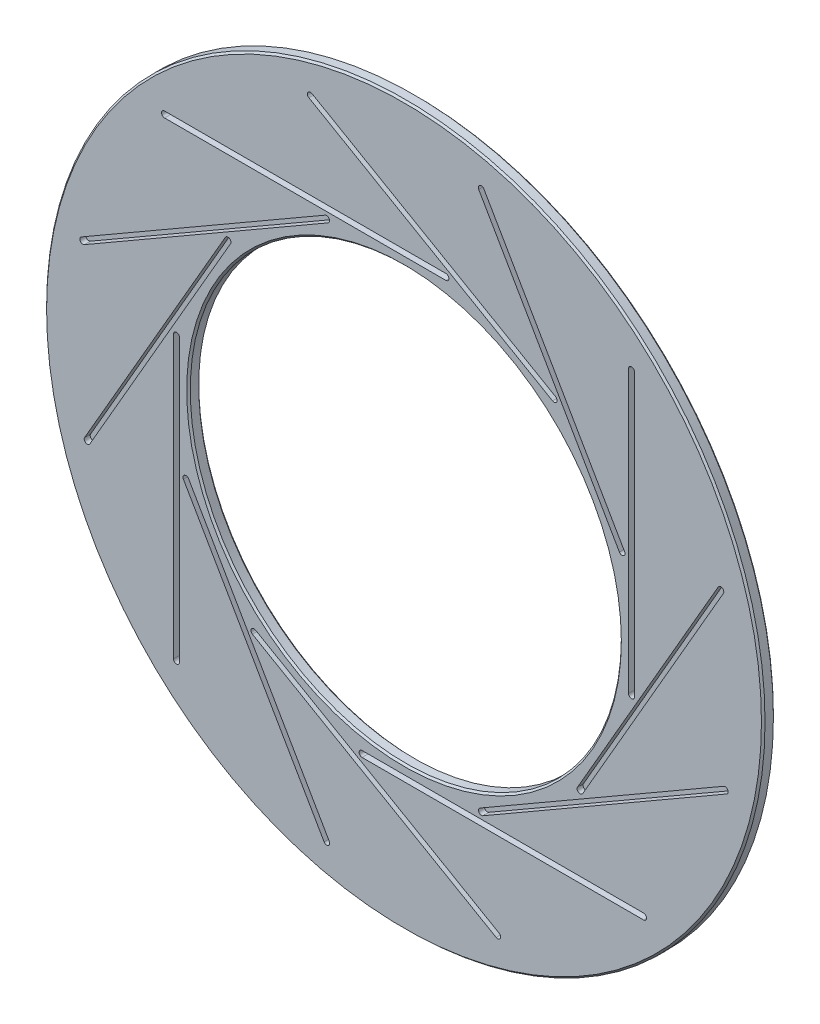
from build123d import *

# Parameters (mm, degrees)
SKETCH1_R           = 60
SKETCH1_R_2         = 36
BOSS_EXTRUDE1_DEPTH = 2
CUT_EXTRUDE1_DEPTH  = 1
CIRPATTERN1_COUNT   = 12
CHAMFER1_SIZE       = 0.3


with BuildPart() as part:
    # Sketch1 → Boss-Extrude1 (new body)
    with BuildSketch(Plane.XY):
        Circle(SKETCH1_R)
        Circle(SKETCH1_R_2, mode=Mode.SUBTRACT)
    extrude(amount=BOSS_EXTRUDE1_DEPTH)

    # Sketch2 → Cut-Extrude1 (cut)
    with BuildSketch(Plane.XY.offset(2)):
        with BuildLine():
            Line((-40, 38.5), (7, 38.5))
            ThreePointArc((7, 38.5), (7.5, 38), (7, 37.5))
            Line((7, 37.5), (-40, 37.5))
            ThreePointArc((-40, 37.5), (-40.5, 38), (-40, 38.5))
        make_face()
    cut_extrude1 = extrude(amount=-CUT_EXTRUDE1_DEPTH, mode=Mode.SUBTRACT)

    # CirPattern1: Cut-Extrude1 ×12 about axis
    cirpattern1_axis = Axis((0, 0, 0), (0, 0, 1))
    for i in range(1, CIRPATTERN1_COUNT):
        add(cut_extrude1.rotate(cirpattern1_axis, i * 360 / CIRPATTERN1_COUNT), mode=Mode.SUBTRACT)

    # Chamfer1
    chamfer1_edges = [part.edges().sort_by_distance(p)[0] for p in [
        (-60, 0, 0),
        (-60, 0, 2),
        (-36, 0, 0),
        (-36, 0, 2),
    ]]
    chamfer(chamfer1_edges, length=CHAMFER1_SIZE)


solid = part.part
